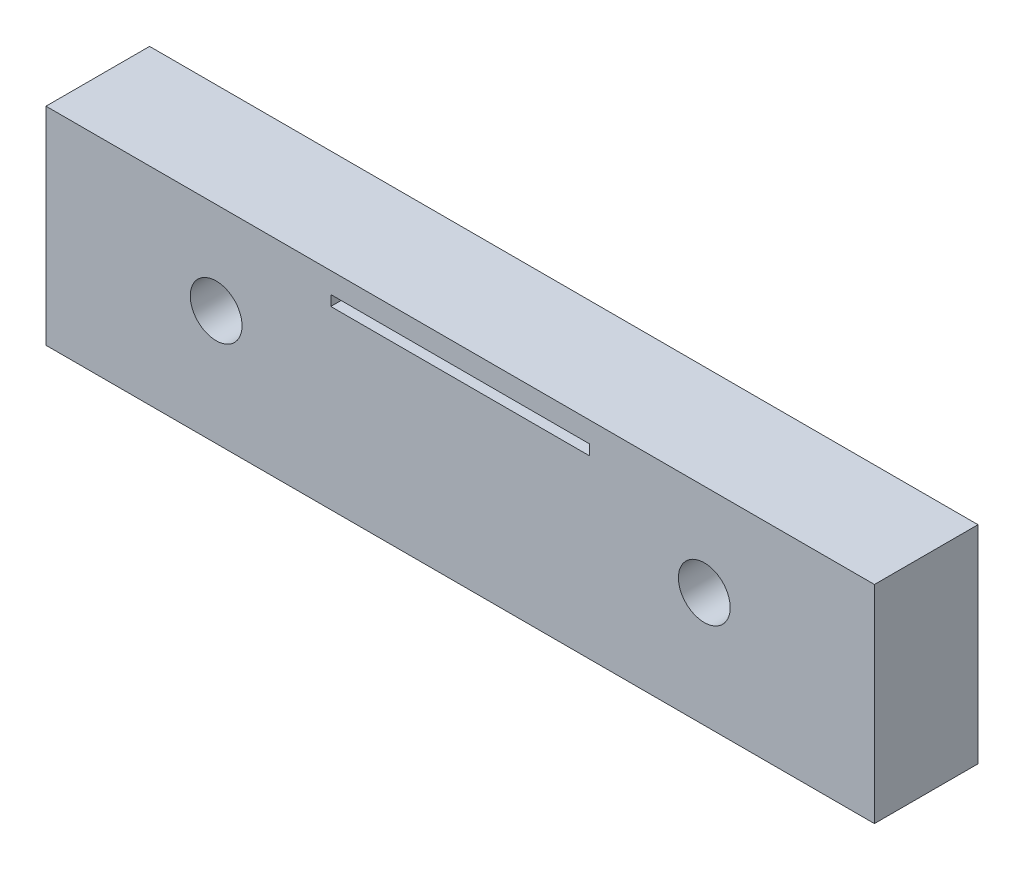
from build123d import *

# Parameters (mm, degrees)
SKETCH1_W           = 80
SKETCH1_H           = 20
BOSS_EXTRUDE1_DEPTH = 10
SKETCH2_R           = 2.5
CUT_EXTRUDE1_DEPTH  = 47.813641243
SKETCH3_W           = 25
SKETCH3_H           = 1
CUT_EXTRUDE2_DEPTH  = 47.813641243


with BuildPart() as part:
    # Sketch1 → Boss-Extrude1 (new body)
    with BuildSketch(Plane.XY):
        with Locations((-0.372188153, 11.484958231)):
            Rectangle(SKETCH1_W, SKETCH1_H)
    extrude(amount=BOSS_EXTRUDE1_DEPTH)

    # Sketch2 → Cut-Extrude1 (cut, through all)
    with BuildSketch(Plane.XY.offset(10)):
        with Locations((-23.942188153, 12.584958231)):
            Circle(SKETCH2_R)
        with Locations(Location((23.197811847, 12.584958231, 0), (0, 0, 180))):
            Circle(SKETCH2_R)
    extrude(amount=-CUT_EXTRUDE1_DEPTH, mode=Mode.SUBTRACT)

    # Sketch3 → Cut-Extrude2 (cut, through all)
    with BuildSketch(Plane.XY.offset(10)):
        with Locations((-0.372188153, 18.984958231)):
            Rectangle(SKETCH3_W, SKETCH3_H)
    extrude(amount=-CUT_EXTRUDE2_DEPTH, mode=Mode.SUBTRACT)


solid = part.part
